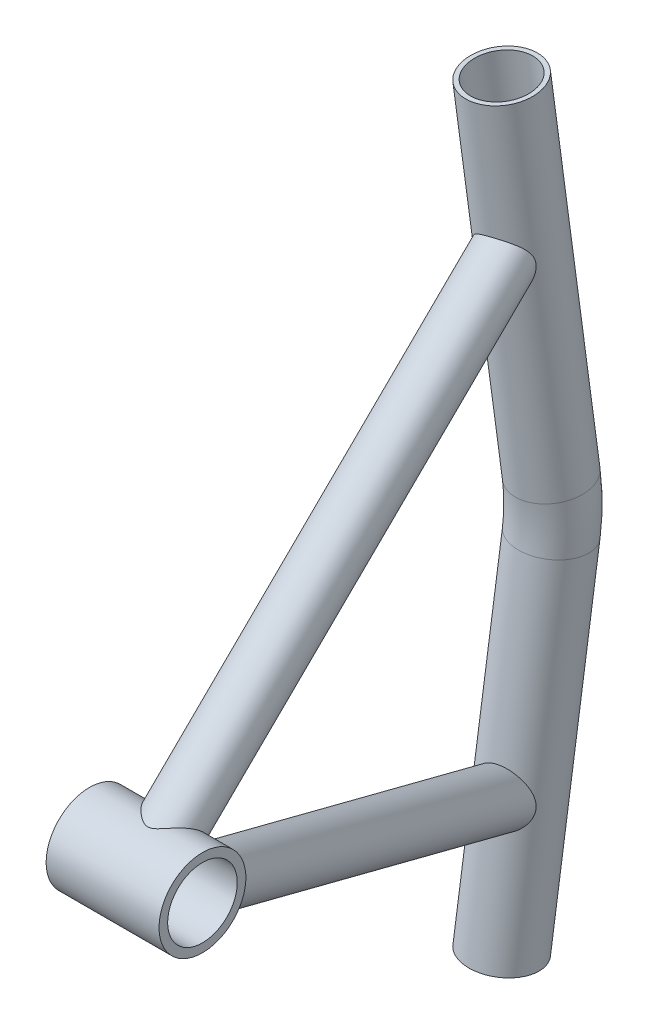
from build123d import *

# Parameters (mm, degrees)
SKETCH6_W                = 41.275
SKETCH6_H                = 3.1496
BOSS_EXTRUDE1_REACH      = 236.173
BOSS_EXTRUDE1_END_RADIUS = 15.875
SKETCH10_R               = 9.525
SKETCH10_R_2             = 7.874
BOSS_EXTRUDE2_REACH      = 282.766
BOSS_EXTRUDE2_END_RADIUS = 15.875
SKETCH11_R               = 9.525
SKETCH11_R_2             = 7.874
SKETCH12_R               = 12.7
SKETCH15_R               = 12.7
SKETCH15_R_2             = 11.049


with BuildPart() as part:
    # Sketch6 → Revolve2 (revolve)
    with BuildSketch(Plane(origin=(0, 0, 0), x_dir=(1, 0, 0), z_dir=(0, 1, 0)), mode=Mode.PRIVATE) as revolve2_sk:
        with Locations((0, 14.3002)):
            Rectangle(SKETCH6_W, SKETCH6_H)
    revolve(revolve2_sk.sketch.rotate(Axis((-66.78681796, 0, 0), (1, 0, 0)), 180), axis=Axis((-66.78681796, 0, 0), (1, 0, 0)))


with BuildPart() as body_2:
    # Boss-Extrude1: up to this cylinder (the profile starts outside it)
    boss_extrude1_end = Plane(origin=(-45.678868, 0, 0), z_dir=(-1, 0, 0)) * Cylinder(BOSS_EXTRUDE1_END_RADIUS, 505.096, mode=Mode.PRIVATE)
    # Sketch10 → Boss-Extrude1 (new, up to the surface)
    with BuildSketch(Plane(origin=(-45.678868166, 89.236316096, -182.596530613), x_dir=(-0.9718118422845563, -0.0976765843565974, 0.21457173174471322), z_dir=(-0.23575780622388026, 0.4026304066534569, -0.8844812109042087)), mode=Mode.PRIVATE) as boss_extrude1_sk1:
        with Locations(Location((0, 0, 0), (0, 0, 90))):
            Circle(SKETCH10_R)
        with Locations(Location((0, 0, 0), (0, 0, 90))):
            Circle(SKETCH10_R_2, mode=Mode.SUBTRACT)
    boss_extrude1_tool1 = extrude(boss_extrude1_sk1.sketch, amount=-BOSS_EXTRUDE1_REACH, mode=Mode.PRIVATE) - boss_extrude1_end
    add(boss_extrude1_tool1.solids().sort_by_distance((-45.678868, 80.812466, -186.431206))[0])


with BuildPart() as body_3:
    # Boss-Extrude2: up to this cylinder (the profile starts outside it)
    boss_extrude2_end = Plane(origin=(-45.678868, 0, 0), z_dir=(-1, 0, 0)) * Cylinder(BOSS_EXTRUDE2_END_RADIUS, 598.282, mode=Mode.PRIVATE)
    # Sketch11 → Boss-Extrude2 (new, up to the surface)
    with BuildSketch(Plane(origin=(-45.678868166, -89.236316096, -182.596530613), x_dir=(-0.9718118422845565, 0.09767658435659736, 0.214571731744713), z_dir=(-0.23575780622387998, -0.4026304066534572, -0.8844812109042086)), mode=Mode.PRIVATE) as boss_extrude2_sk1:
        with Locations(Location((0, 0, 0), (0, 0, 90))):
            Circle(SKETCH11_R)
        with Locations(Location((0, 0, 0), (0, 0, 90))):
            Circle(SKETCH11_R_2, mode=Mode.SUBTRACT)
    boss_extrude2_tool1 = extrude(boss_extrude2_sk1.sketch, amount=-BOSS_EXTRUDE2_REACH, mode=Mode.PRIVATE) - boss_extrude2_end
    add(boss_extrude2_tool1.solids().sort_by_distance((-45.678868, -97.660166, -178.761855))[0])


with BuildPart() as cut_sweep1_tool:
    # Cut-Sweep1: sweep along a curve in space
    with BuildLine() as cut_sweep1_path:
        Line((-47.937055144, 138.471469808, -177.943551359), (-42.011992023, 9.287572997, -190.152104526))
        ThreePointArc((-42.011992023, 9.287572997, -190.152104526), (-41.79958754, 0, -190.589762549), (-42.011992023, -9.287572997, -190.152104526))
        Line((-42.011992023, -9.287572997, -190.152104526), (-47.937055144, -138.471469808, -177.943551359))
    # Sketch12 → Cut-Sweep1 (sweep)
    with BuildSketch(Plane(origin=(-47.937055144, -138.471469808, -177.943551359), x_dir=(-0.9989591236170097, 0.04541201261726833, -0.00429167244618278), z_dir=(-0.045614354564503724, -0.9945278138635107, 0.0939880742941884))):
        Circle(SKETCH12_R)
    sweep(path=cut_sweep1_path.line)


with BuildPart() as body_2_1:
    add(body_2.part)

    # Cut-Sweep1: cut by cut_sweep1_tool
    add(cut_sweep1_tool.part, mode=Mode.SUBTRACT)


with BuildPart() as body_3_1:
    add(body_3.part)

    # Cut-Sweep1: cut by cut_sweep1_tool
    add(cut_sweep1_tool.part, mode=Mode.SUBTRACT)


with BuildPart() as body_4:
    # Sweep2: sweep along a path in Sketch14
    with BuildLine(Plane(origin=(-108.695110163, 0, -52.751982968), x_dir=(0.43661741575798063, 0, -0.8996472821371845), z_dir=(0.8996472821371845, 0, 0.43661741575798063))) as sweep2_path:
        Line((139.156279218, 138.471469808), (152.726656641, 9.287572997))
        ThreePointArc((152.726656641, 9.287572997), (153.213133989, 0), (152.726656641, -9.287572997))
        Line((152.726656641, -9.287572997), (139.156279218, -138.471469808))
    # Sketch15 → Sweep2 (sweep)
    with BuildSketch(Plane(origin=(-47.937055144, -138.471469808, -177.943551359), x_dir=(-0.9989591236170097, 0.04541201261726833, -0.00429167244618278), z_dir=(-0.045614354564503724, -0.9945278138635107, 0.0939880742941884))):
        Circle(SKETCH15_R)
        Circle(SKETCH15_R_2, mode=Mode.SUBTRACT)
    sweep(path=sweep2_path.line)


solid = Compound([part.part, body_2_1.part, body_3_1.part, body_4.part])
